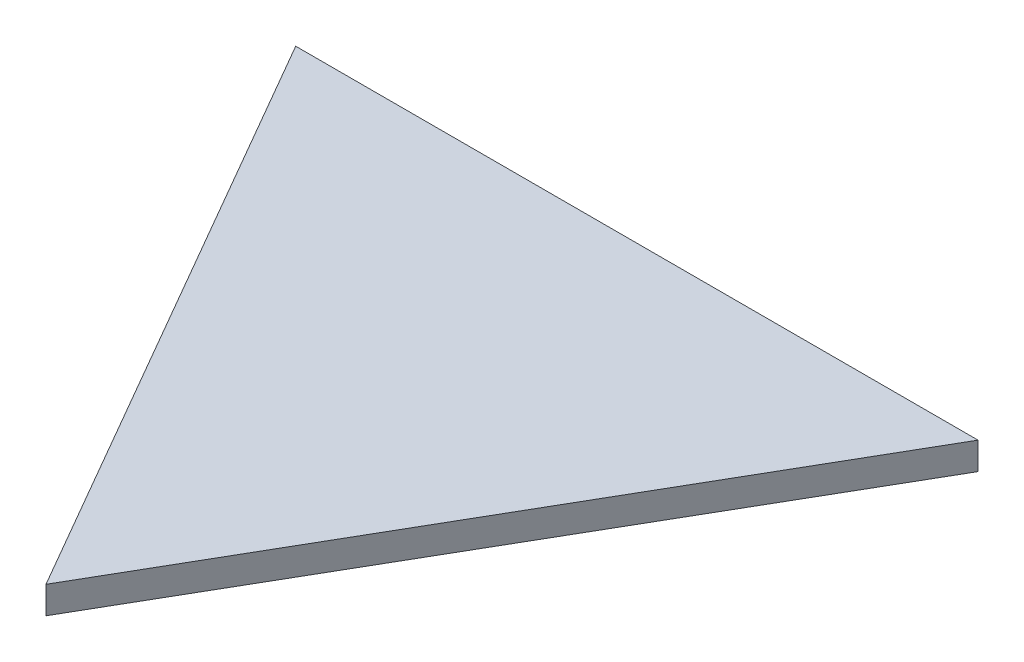
from build123d import *

# Parameters (mm, degrees)
EXTRUDE1_DEPTH = 10


with BuildPart() as part:
    # Sketch1 → Extrude1 (new body)
    with BuildSketch(Plane(origin=(0, 0, 0), x_dir=(1, 0, 0), z_dir=(0, 1, 0))):
        Polygon((-125, 72.16), (0, -144.34), (125, 72.16), align=None)
    extrude(amount=EXTRUDE1_DEPTH)


solid = part.part
